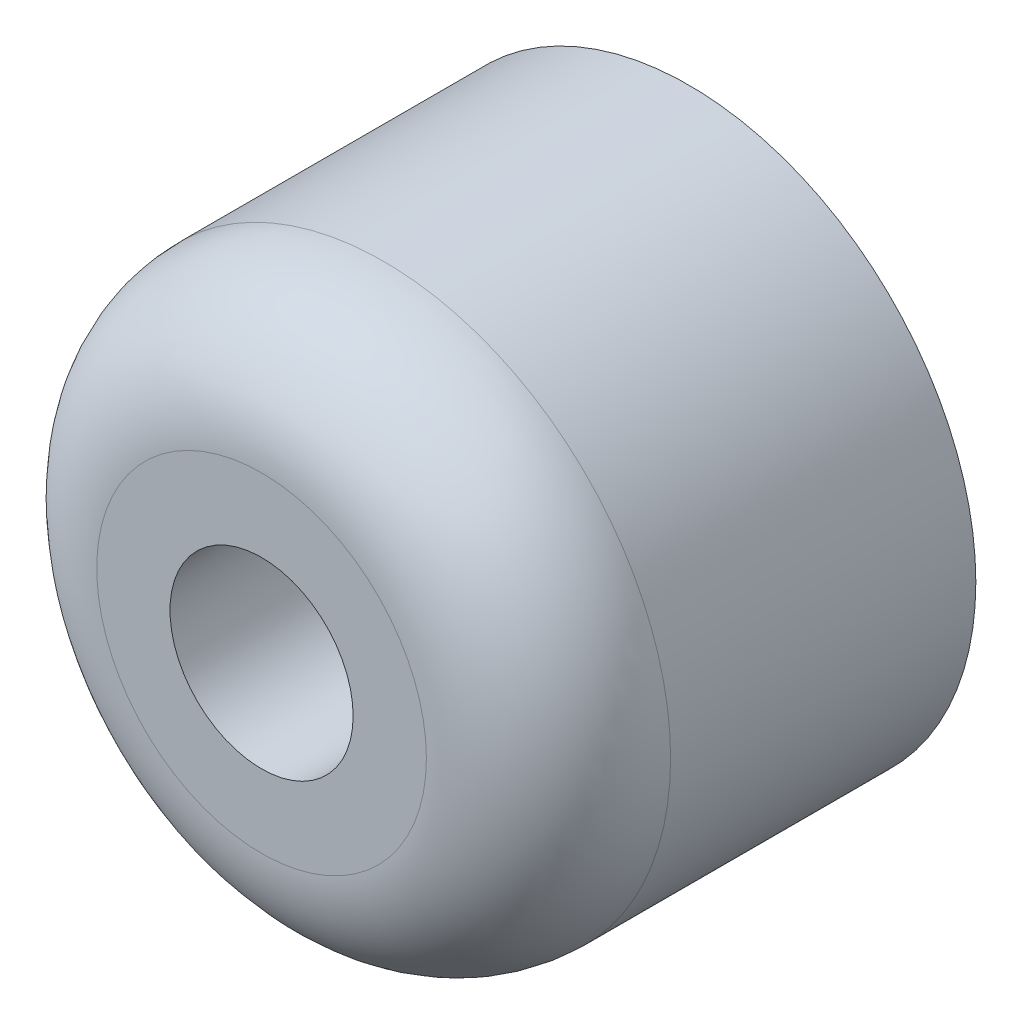
from build123d import *

# Parameters (mm, degrees)
SKETCH_2_R          = 23.5
EXTRUDE_1_DEPTH     = 35
FILLET_3_R          = 10
SHELL_2_T           = -2
SKETCH_5_R          = 9.5
EXTRUDE_2_DEPTH     = 33
SKETCH_6_R          = 2.4
CUT_EXTRUDE_1_DEPTH = 49.264894074
EXTRUDE_3_REACH     = 50.265
SKETCH_7_W          = 1.2
SKETCH_7_H          = 13
SKETCH_8_R          = 7.5
CUT_EXTRUDE_2_DEPTH = 22.5
CHAMFER_1_SIZE      = 3


with BuildPart() as part:
    # Эскиз2 → Бобышка-Вытянуть1 (new body)
    with BuildSketch(Plane.XY):
        Circle(SKETCH_2_R)
    extrude(amount=EXTRUDE_1_DEPTH)

    # Скругление3
    fillet_3_edges = [part.edges().sort_by_distance(p)[0] for p in [
        (-23.5, 0, 35),
    ]]
    fillet(fillet_3_edges, radius=FILLET_3_R)

    # Оболочка2
    shell_2_openings = [part.faces().sort_by_distance(p)[0] for p in [
        (0, 0, 0),
    ]]
    offset(amount=SHELL_2_T, openings=shell_2_openings, kind=Kind.INTERSECTION)

    # Эскиз5 → Бобышка-Вытянуть2 (add)
    with BuildSketch(Plane(origin=(0, 0, 33), x_dir=(-1, 0, 0), z_dir=(0, 0, -1))):
        with Locations(Location((0, 0, 0), (0, 0, 180))):
            Circle(SKETCH_5_R)
    extrude(amount=EXTRUDE_2_DEPTH)

    # Эскиз6 → Вырез-Вытянуть1 (cut, through all)
    with BuildSketch(Plane(origin=(0, 0, 0), x_dir=(-1, 0, 0), z_dir=(0, 0, -1))):
        Circle(SKETCH_6_R)
    extrude(amount=-CUT_EXTRUDE_1_DEPTH, mode=Mode.SUBTRACT)

    # Эскиз7 → Бобышка-Вытянуть3 (add, up to next)
    with BuildSketch(Plane(origin=(0, 0, 0), x_dir=(-1, 0, 0), z_dir=(0, 0, -1)), mode=Mode.PRIVATE) as extrude_3_sk1:
        with Locations((0, 15.437627965)):
            Rectangle(SKETCH_7_W, SKETCH_7_H)
    extrude_3_tool1 = extrude(extrude_3_sk1.sketch, amount=-EXTRUDE_3_REACH, mode=Mode.PRIVATE) - part.part
    # Эскиз7 → Бобышка-Вытянуть3 (add, up to next)
    with BuildSketch(Plane(origin=(0, 0, 0), x_dir=(-1, 0, 0), z_dir=(0, 0, -1)), mode=Mode.PRIVATE) as extrude_3_sk2:
        Polygon((7.440212867, 4.988429225), (18.698543116, 11.488429225), (19.298543116, 10.44919874), (8.040212867, 3.94919874), align=None)
    extrude_3_tool2 = extrude(extrude_3_sk2.sketch, amount=-EXTRUDE_3_REACH, mode=Mode.PRIVATE) - part.part
    # Эскиз7 → Бобышка-Вытянуть3 (add, up to next)
    with BuildSketch(Plane(origin=(0, 0, 0), x_dir=(-1, 0, 0), z_dir=(0, 0, -1)), mode=Mode.PRIVATE) as extrude_3_sk3:
        Polygon((8.040212867, -3.94919874), (19.298543117, -10.44919874), (18.698543117, -11.488429225), (7.440212867, -4.988429225), align=None)
    extrude_3_tool3 = extrude(extrude_3_sk3.sketch, amount=-EXTRUDE_3_REACH, mode=Mode.PRIVATE) - part.part
    # Эскиз7 → Бобышка-Вытянуть3 (add, up to next)
    with BuildSketch(Plane(origin=(0, 0, 0), x_dir=(-1, 0, 0), z_dir=(0, 0, -1)), mode=Mode.PRIVATE) as extrude_3_sk4:
        with Locations((0, -15.437627965)):
            Rectangle(SKETCH_7_W, SKETCH_7_H)
    extrude_3_tool4 = extrude(extrude_3_sk4.sketch, amount=-EXTRUDE_3_REACH, mode=Mode.PRIVATE) - part.part
    # Эскиз7 → Бобышка-Вытянуть3 (add, up to next)
    with BuildSketch(Plane(origin=(0, 0, 0), x_dir=(-1, 0, 0), z_dir=(0, 0, -1)), mode=Mode.PRIVATE) as extrude_3_sk5:
        Polygon((-7.440212867, -4.988429225), (-18.698543116, -11.488429225), (-19.298543116, -10.44919874), (-8.040212867, -3.94919874), align=None)
    extrude_3_tool5 = extrude(extrude_3_sk5.sketch, amount=-EXTRUDE_3_REACH, mode=Mode.PRIVATE) - part.part
    # Эскиз7 → Бобышка-Вытянуть3 (add, up to next)
    with BuildSketch(Plane(origin=(0, 0, 0), x_dir=(-1, 0, 0), z_dir=(0, 0, -1)), mode=Mode.PRIVATE) as extrude_3_sk6:
        Polygon((-8.040212867, 3.94919874), (-19.298543116, 10.44919874), (-18.698543116, 11.488429225), (-7.440212867, 4.988429225), align=None)
    extrude_3_tool6 = extrude(extrude_3_sk6.sketch, amount=-EXTRUDE_3_REACH, mode=Mode.PRIVATE) - part.part
    add(extrude_3_tool1.solids().sort_by_distance((0, 15.437628, 0))[0])
    add(extrude_3_tool2.solids().sort_by_distance((-13.369378, 7.718814, 0))[0])
    add(extrude_3_tool3.solids().sort_by_distance((-13.369378, -7.718814, 0))[0])
    add(extrude_3_tool4.solids().sort_by_distance((0, -15.437628, 0))[0])
    add(extrude_3_tool5.solids().sort_by_distance((13.369378, -7.718814, 0))[0])
    add(extrude_3_tool6.solids().sort_by_distance((13.369378, 7.718814, 0))[0])

    # Эскиз8 → Вырез-Вытянуть2 (cut)
    with BuildSketch(Plane.XY.offset(35)):
        Circle(SKETCH_8_R)
    extrude(amount=-CUT_EXTRUDE_2_DEPTH, mode=Mode.SUBTRACT)

    # Фаска1
    chamfer_1_edges = [part.edges().sort_by_distance(p)[0] for p in [
        (2.4, 0, 12.5),
    ]]
    chamfer(chamfer_1_edges, length=CHAMFER_1_SIZE)


solid = part.part
